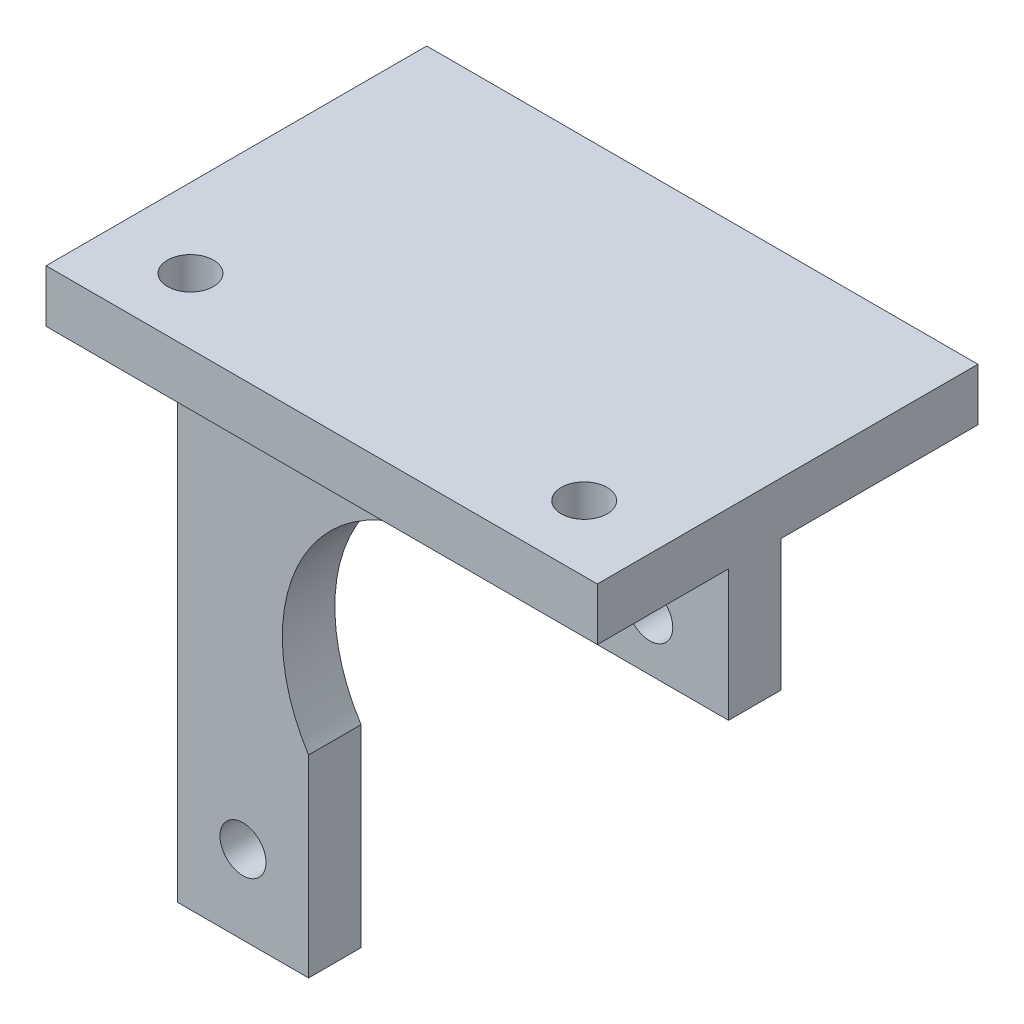
from build123d import *

# Parameters (mm, degrees)
ESBO_O1_R                = 1.75
RESSALTO_EXTRUS_O1_DEPTH = 4
ESBO_O2_W                = 42
ESBO_O2_H                = 29
ESBO_O2_R                = 1.75
RESSALTO_EXTRUS_O2_DEPTH = 4


with BuildPart() as part:
    # Esboço1 → Ressalto-extrusão1 (new body)
    with BuildSketch(Plane.XY):
        with BuildLine():
            Line((-20.5, -21.5), (-20.5, 21.5))
            Line((-20.5, 21.5), (21.5, 21.5))
            Line((21.5, 21.5), (21.5, 11.5))
            Line((21.5, 11.5), (4.898979486, 11.5))
            ThreePointArc((4.898979486, 11.5), (-9.56053111, 8.052716616), (-10.5, -6.782329983))
            Line((-10.5, -6.782329983), (-10.5, -21.5))
            Line((-10.5, -21.5), (-20.5, -21.5))
        make_face()
        with Locations((-15.5, 15.5)):
            Circle(ESBO_O1_R, mode=Mode.SUBTRACT)
        with Locations((15.5, 15.5)):
            Circle(ESBO_O1_R, mode=Mode.SUBTRACT)
        with Locations((-15.5, -15.5)):
            Circle(ESBO_O1_R, mode=Mode.SUBTRACT)
    extrude(amount=RESSALTO_EXTRUS_O1_DEPTH)

    # Esboço2 → Ressalto-extrusão2 (add)
    with BuildSketch(Plane(origin=(0, 21.5, 0), x_dir=(1, 0, 0), z_dir=(0, 1, 0))):
        with Locations((0.5, 0.5)):
            Rectangle(ESBO_O2_W, ESBO_O2_H)
        with Locations(Location((-14.5, -9, 0), (0, 0, 270))):
            Circle(ESBO_O2_R, mode=Mode.SUBTRACT)
        with Locations(Location((15.5, -9, 0), (0, 0, 270))):
            Circle(ESBO_O2_R, mode=Mode.SUBTRACT)
    extrude(amount=RESSALTO_EXTRUS_O2_DEPTH)


solid = part.part
